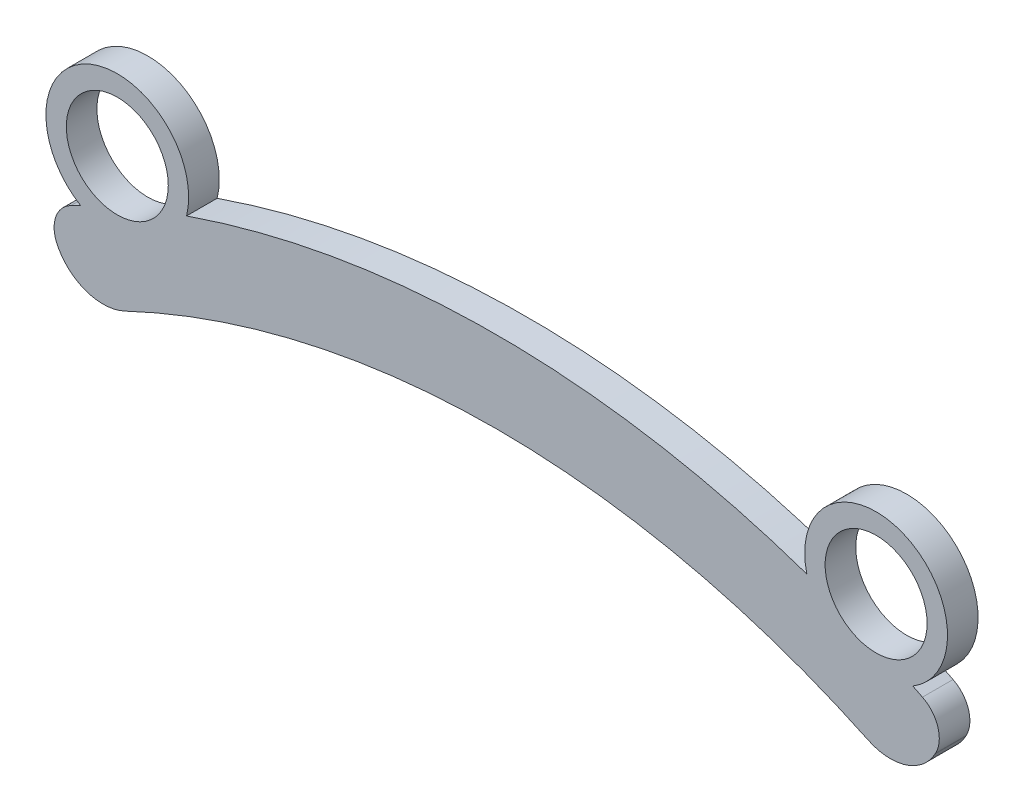
from build123d import *

# Parameters (mm, degrees)
SKETCH1_R           = 5
BOSS_EXTRUDE1_DEPTH = 3
SCALE1_SCALE        = 3


with BuildPart() as part:
    # Sketch1 → Boss-Extrude1 (new body)
    with BuildSketch(Plane.XY):
        with BuildLine():
            ThreePointArc((-41.753986468, 83.099967593), (-43.270314203, 81.314818292), (-43.041341374, 78.983814372))
            Line((-43.041341374, 78.983814372), (-42.998763062, 78.905680247))
            ThreePointArc((-42.998763062, 78.905680247), (-40.153807851, 76.543039354), (-36.463426148, 76.781629011))
            ThreePointArc((-36.463426148, 76.781629011), (0, 85), (36.463426148, 76.781629011))
            ThreePointArc((36.463426148, 76.781629011), (40.153807851, 76.543039354), (42.998763062, 78.905680247))
            Line((42.998763062, 78.905680247), (43.041341374, 78.983814372))
            ThreePointArc((43.041341374, 78.983814372), (43.270314203, 81.314818292), (41.753986468, 83.099967593))
            ThreePointArc((41.753986468, 83.099967593), (41.278907761, 83.336977231), (40.802483763, 83.571270894))
            ThreePointArc((40.802483763, 83.571270894), (39.895257732, 96.043575582), (30.418144359, 87.884791026))
            ThreePointArc((30.418144359, 87.884791026), (0, 93), (-30.418144359, 87.884791026))
            ThreePointArc((-30.418144359, 87.884791026), (-39.895257732, 96.043575582), (-40.802483763, 83.571270894))
            ThreePointArc((-40.802483763, 83.571270894), (-41.278907761, 83.336977231), (-41.753986468, 83.099967593))
        make_face()
        with Locations((-37.21, 89.579104148)):
            Circle(SKETCH1_R, mode=Mode.SUBTRACT)
        with Locations((37.21, 89.579104148)):
            Circle(SKETCH1_R, mode=Mode.SUBTRACT)
    extrude(amount=BOSS_EXTRUDE1_DEPTH)


with BuildPart() as part_1:
    # Scale1: scaled about (0, 86.37118339, 1.5)
    add(part.part.scale(SCALE1_SCALE).moved(Location((0, -172.74236678, -3))))


solid = part_1.part
